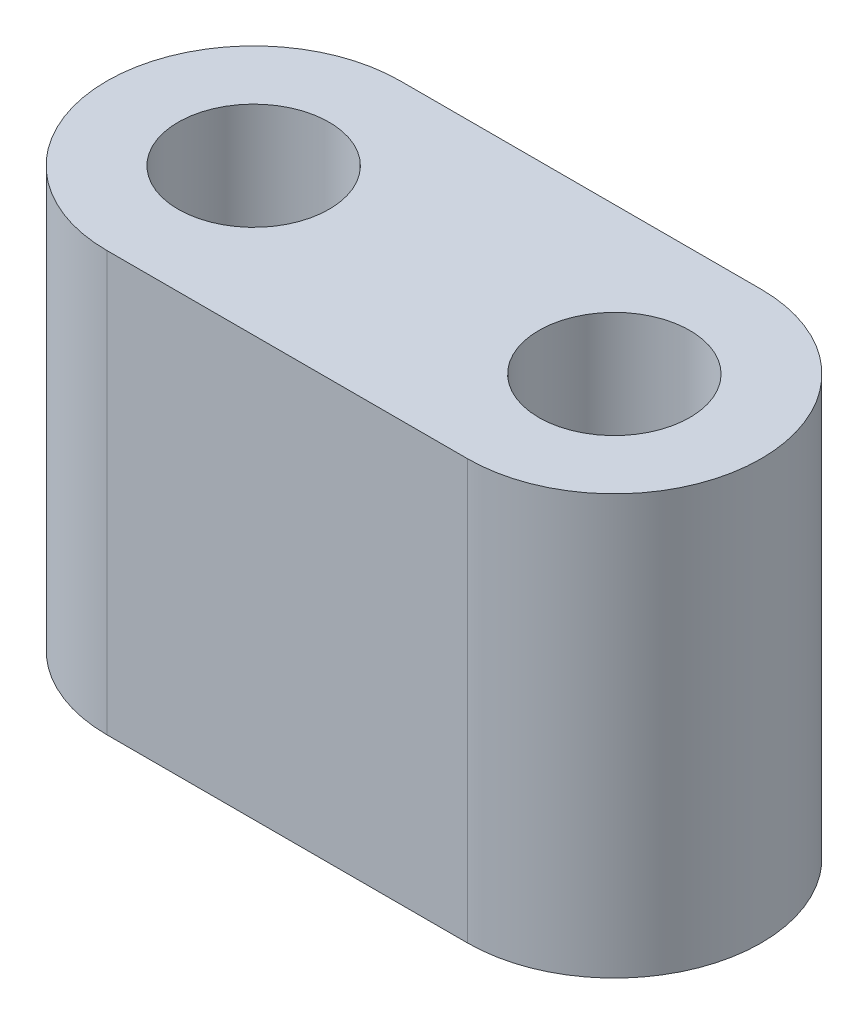
from build123d import *

# Parameters (mm, degrees)
SKETCH1_R           = 1.8
BOSS_EXTRUDE1_DEPTH = 5


with BuildPart() as part:
    # Sketch1 → Boss-Extrude1 (new, symmetric)
    with BuildSketch(Plane(origin=(0, 0, 0), x_dir=(1, 0, 0), z_dir=(0, 1, 0))):
        with BuildLine():
            Line((-4.3, 3.5), (4.3, 3.5))
            ThreePointArc((4.3, 3.5), (7.8, 0), (4.3, -3.5))
            Line((4.3, -3.5), (-4.3, -3.5))
            ThreePointArc((-4.3, -3.5), (-7.8, 0), (-4.3, 3.5))
        make_face()
        with Locations((-4.3, 0)):
            Circle(SKETCH1_R, mode=Mode.SUBTRACT)
        with Locations((4.3, 0)):
            Circle(SKETCH1_R, mode=Mode.SUBTRACT)
    extrude(amount=BOSS_EXTRUDE1_DEPTH, both=True)


solid = part.part
